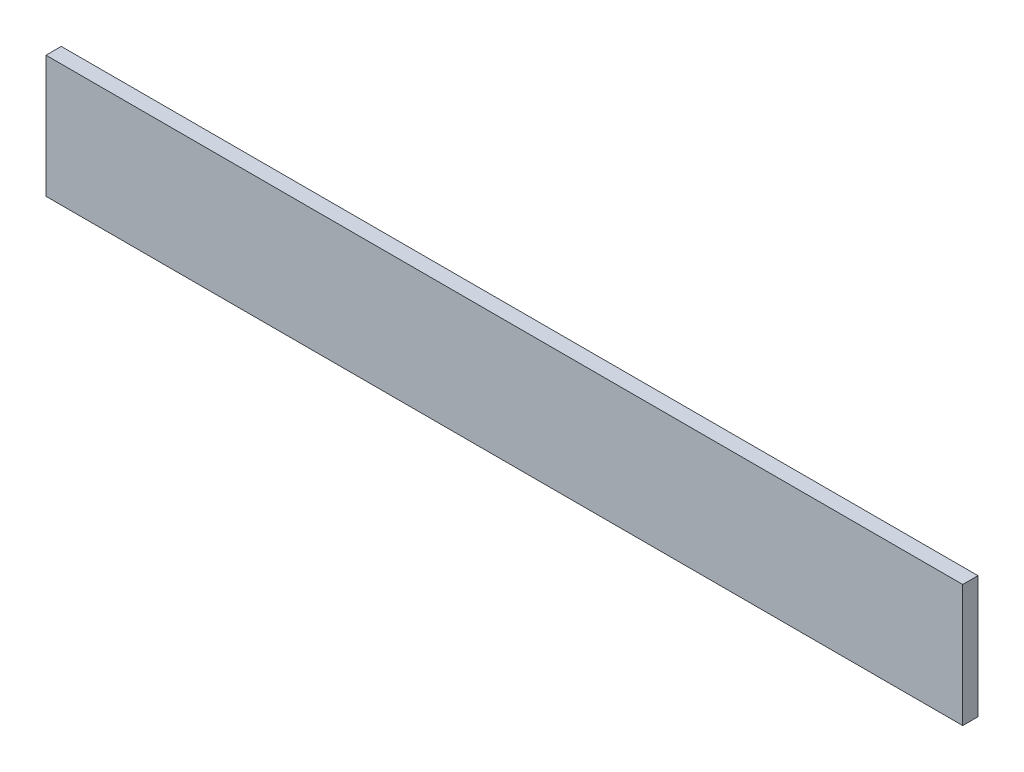
from build123d import *

# Parameters (mm, degrees)
ESQUISSE1_W        = 120
ESQUISSE1_H        = 16
BOSS_EXTRU_1_DEPTH = 2


with BuildPart() as part:
    # Esquisse1 → Boss.-Extru.1 (new body)
    with BuildSketch(Plane.XY):
        Rectangle(ESQUISSE1_W, ESQUISSE1_H)
    extrude(amount=BOSS_EXTRU_1_DEPTH)


solid = part.part
